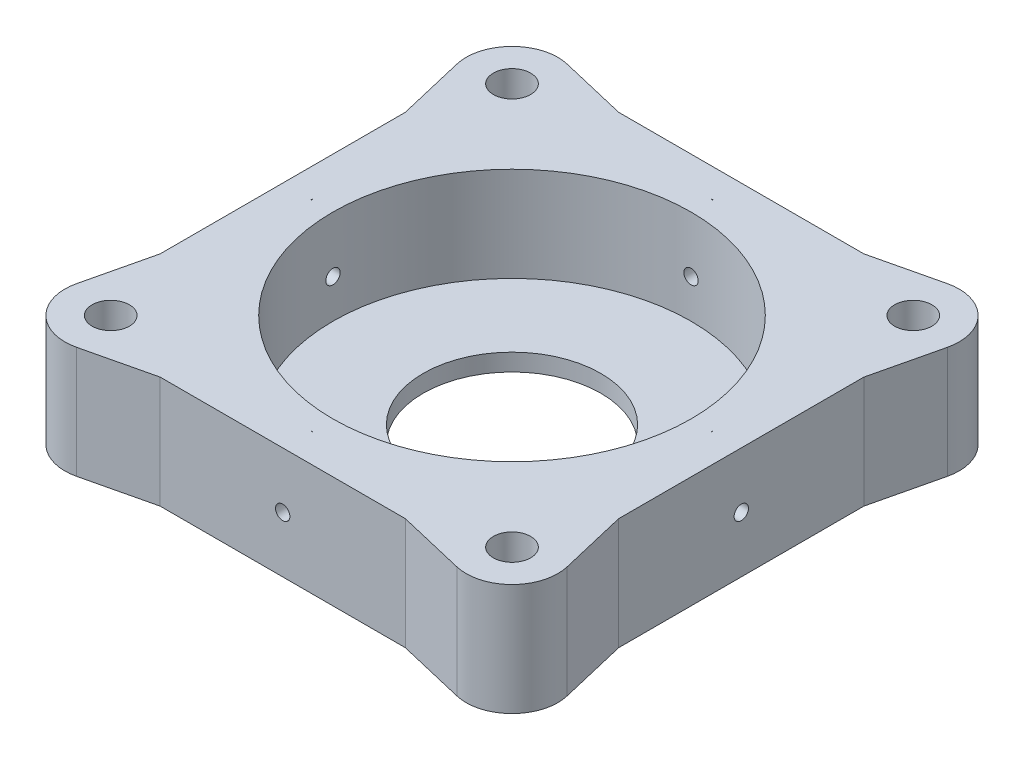
from build123d import *

# Parameters (mm, degrees)
SKETCH1_R           = 34
SKETCH1_R_2         = 15.5
BOSS_EXTRUDE1_DEPTH = 19.5
SKETCH2_R           = 31.25
CUT_EXTRUDE1_DEPTH  = 16.5
SKETCH3_R           = 5
CUT_EXTRUDE2_DEPTH  = 6
CUT_EXTRUDE3_REACH  = 97.49
SKETCH4_R           = 1.25
CUT_EXTRUDE4_REACH  = 97.49
SKETCH5_R           = 1.25


with BuildPart() as part:
    # Sketch1 → Boss-Extrude1 (new body)
    # profile 1 of 61: a face of its own
    with BuildSketch(Plane(origin=(0, 0, 0), x_dir=(1, 0, 0), z_dir=(0, 1, 0))):
        with BuildLine():
            ThreePointArc((-33.157842357, 42.785014786), (-40.656854249, 40.656854249), (-42.785014786, 33.157842357))
            ThreePointArc((-42.785014786, 33.157842357), (-41.760946795, 30.723365993), (-40, 28.755002002))
            Line((-40, 28.755002002), (-40, 40))
            Line((-40, 40), (-28.755002002, 40))
            ThreePointArc((-28.755002002, 40), (-30.723365993, 41.760946795), (-33.157842357, 42.785014786))
        make_face()
    # profile 2 of 61: a face of its own
    with BuildSketch(Plane(origin=(0, 0, 0), x_dir=(1, 0, 0), z_dir=(0, 1, 0))):
        with BuildLine():
            ThreePointArc((-40, 28.755002002), (-37.649529771, 27.451490744), (-35, 27))
            Line((-35, 27), (-35, 31.75))
            ThreePointArc((-35, 31.75), (-37.298097039, 37.298097039), (-31.75, 35))
            Line((-31.75, 35), (-27, 35))
            ThreePointArc((-27, 35), (-27.451490744, 37.649529771), (-28.755002002, 40))
            Line((-28.755002002, 40), (-40, 40))
            Line((-40, 40), (-40, 28.755002002))
        make_face()
    # profile 3 of 61: a face of its own
    with BuildSketch(Plane(origin=(0, 0, 0), x_dir=(1, 0, 0), z_dir=(0, 1, 0))):
        with BuildLine():
            Line((-35, 31.75), (-35, 27))
            ThreePointArc((-35, 27), (-29.343145751, 29.343145751), (-27, 35))
            Line((-27, 35), (-31.75, 35))
            ThreePointArc((-31.75, 35), (-32.701902961, 32.701902961), (-35, 31.75))
        make_face()
    # profile 4 of 61: a face of its own
    with BuildSketch(Plane(origin=(0, 0, 0), x_dir=(1, 0, 0), z_dir=(0, 1, 0))):
        with BuildLine():
            Line((-42.785014786, 33.157842357), (-40, 21.388284323))
            Line((-40, 21.388284323), (-40, 28.755002002))
            ThreePointArc((-40, 28.755002002), (-41.760946795, 30.723365993), (-42.785014786, 33.157842357))
        make_face()
    # profile 5 of 61: a face of its own
    with BuildSketch(Plane(origin=(0, 0, 0), x_dir=(1, 0, 0), z_dir=(0, 1, 0))):
        with BuildLine():
            ThreePointArc((-37.938396612, 12.675885078), (-36.622236567, 16.087628439), (-35, 19.364916731))
            Line((-35, 19.364916731), (-35, 27))
            ThreePointArc((-35, 27), (-37.649529771, 27.451490744), (-40, 28.755002002))
            Line((-40, 28.755002002), (-40, 21.388284323))
            Line((-40, 21.388284323), (-37.938396612, 12.675885078))
        make_face()
    # profile 6 of 61: a face of its own
    with BuildSketch(Plane(origin=(0, 0, 0), x_dir=(1, 0, 0), z_dir=(0, 1, 0))):
        with BuildLine():
            Line((-40, 21.388284323), (-40, 0))
            ThreePointArc((-40, 0), (-39.481235191, 6.421220115), (-37.938396612, 12.675885078))
            Line((-37.938396612, 12.675885078), (-40, 21.388284323))
        make_face()
    # profile 7 of 61: a face of its own
    with BuildSketch(Plane(origin=(0, 0, 0), x_dir=(1, 0, 0), z_dir=(0, 1, 0))):
        with BuildLine():
            Line((-37.938396612, 12.675885078), (-35, 0.258130737))
            Line((-35, 0.258130737), (-35, 19.364916731))
            ThreePointArc((-35, 19.364916731), (-36.622236567, 16.087628439), (-37.938396612, 12.675885078))
        make_face()
    # profile 8 of 61: a face of its own
    with BuildSketch(Plane(origin=(0, 0, 0), x_dir=(1, 0, 0), z_dir=(0, 1, 0))):
        with BuildLine():
            Line((-37.938396612, -12.675885078), (-35, -0.258130737))
            Line((-35, -0.258130737), (-35, 0.258130737))
            Line((-35, 0.258130737), (-37.938396612, 12.675885078))
            ThreePointArc((-37.938396612, 12.675885078), (-39.481235191, 6.421220115), (-40, 0))
            ThreePointArc((-40, 0), (-39.481235191, -6.421220115), (-37.938396612, -12.675885078))
        make_face()
    # profile 9 of 61: a face of its own
    with BuildSketch(Plane(origin=(0, 0, 0), x_dir=(1, 0, 0), z_dir=(0, 1, 0))):
        with BuildLine():
            Line((-40, -21.388284323), (-37.938396612, -12.675885078))
            ThreePointArc((-37.938396612, -12.675885078), (-39.481235191, -6.421220115), (-40, 0))
            Line((-40, 0), (-40, -21.388284323))
        make_face()
    # profile 10 of 61: a face of its own
    with BuildSketch(Plane(origin=(0, 0, 0), x_dir=(1, 0, 0), z_dir=(0, 1, 0))):
        with BuildLine():
            ThreePointArc((-37.938396612, -12.675885078), (-36.622236567, -16.087628439), (-35, -19.364916731))
            Line((-35, -19.364916731), (-35, -0.258130737))
            Line((-35, -0.258130737), (-37.938396612, -12.675885078))
        make_face()
    # profile 11 of 61: a face of its own
    with BuildSketch(Plane(origin=(0, 0, 0), x_dir=(1, 0, 0), z_dir=(0, 1, 0))):
        with BuildLine():
            ThreePointArc((-40, -28.755002002), (-37.649529771, -27.451490744), (-35, -27))
            Line((-35, -27), (-35, -19.364916731))
            ThreePointArc((-35, -19.364916731), (-36.622236567, -16.087628439), (-37.938396612, -12.675885078))
            Line((-37.938396612, -12.675885078), (-40, -21.388284323))
            Line((-40, -21.388284323), (-40, -28.755002002))
        make_face()
    # profile 12 of 61: a face of its own
    with BuildSketch(Plane(origin=(0, 0, 0), x_dir=(1, 0, 0), z_dir=(0, 1, 0))):
        with BuildLine():
            ThreePointArc((-42.785014786, -33.157842357), (-41.760946795, -30.723365993), (-40, -28.755002002))
            Line((-40, -28.755002002), (-40, -21.388284323))
            Line((-40, -21.388284323), (-42.785014786, -33.157842357))
        make_face()
    # profile 13 of 61: a face of its own
    with BuildSketch(Plane(origin=(0, 0, 0), x_dir=(1, 0, 0), z_dir=(0, 1, 0))):
        with BuildLine():
            ThreePointArc((-33.157842357, -42.785014786), (-30.723365993, -41.760946795), (-28.755002002, -40))
            Line((-28.755002002, -40), (-40, -40))
            Line((-40, -40), (-40, -28.755002002))
            ThreePointArc((-40, -28.755002002), (-41.760946795, -30.723365993), (-42.785014786, -33.157842357))
            ThreePointArc((-42.785014786, -33.157842357), (-40.656854249, -40.656854249), (-33.157842357, -42.785014786))
        make_face()
    # profile 14 of 61: a face of its own
    with BuildSketch(Plane(origin=(0, 0, 0), x_dir=(1, 0, 0), z_dir=(0, 1, 0))):
        with BuildLine():
            ThreePointArc((-28.755002002, -40), (-27.451490744, -37.649529771), (-27, -35))
            Line((-27, -35), (-31.75, -35))
            ThreePointArc((-31.75, -35), (-37.298097039, -37.298097039), (-35, -31.75))
            Line((-35, -31.75), (-35, -27))
            ThreePointArc((-35, -27), (-37.649529771, -27.451490744), (-40, -28.755002002))
            Line((-40, -28.755002002), (-40, -40))
            Line((-40, -40), (-28.755002002, -40))
        make_face()
    # profile 15 of 61: a face of its own
    with BuildSketch(Plane(origin=(0, 0, 0), x_dir=(1, 0, 0), z_dir=(0, 1, 0))):
        with BuildLine():
            Line((-31.75, -35), (-27, -35))
            ThreePointArc((-27, -35), (-29.343145751, -29.343145751), (-35, -27))
            Line((-35, -27), (-35, -31.75))
            ThreePointArc((-35, -31.75), (-32.701902961, -32.701902961), (-31.75, -35))
        make_face()
    # profile 16 of 61: a face of its own
    with BuildSketch(Plane(origin=(0, 0, 0), x_dir=(1, 0, 0), z_dir=(0, 1, 0))):
        with BuildLine():
            ThreePointArc((-35, -27), (-29.343145751, -29.343145751), (-27, -35))
            Line((-27, -35), (-19.364916731, -35))
            ThreePointArc((-19.364916731, -35), (-28.284271247, -28.284271247), (-35, -19.364916731))
            Line((-35, -19.364916731), (-35, -27))
        make_face()
    # profile 17 of 61: a face of its own
    with BuildSketch(Plane(origin=(0, 0, 0), x_dir=(1, 0, 0), z_dir=(0, 1, 0))):
        with BuildLine():
            ThreePointArc((-35, -19.364916731), (-28.284271247, -28.284271247), (-19.364916731, -35))
            Line((-19.364916731, -35), (-0.258130737, -35))
            Line((-0.258130737, -35), (0, -34.938918869))
            Line((0, -34.938918869), (-7.829169983, -33.08631284))
            ThreePointArc((-7.829169983, -33.08631284), (-24.04163056, -24.04163056), (-33.08631284, -7.829169983))
            Line((-33.08631284, -7.829169983), (-34.938918869, 0))
            Line((-34.938918869, 0), (-35, -0.258130737))
            Line((-35, -0.258130737), (-35, -19.364916731))
        make_face()
    # profile 18 of 61: a face of its own
    with BuildSketch(Plane(origin=(0, 0, 0), x_dir=(1, 0, 0), z_dir=(0, 1, 0))):
        with BuildLine():
            Line((-35, 19.364916731), (-35, 0.258130737))
            Line((-35, 0.258130737), (-34.938918869, 0))
            Line((-34.938918869, 0), (-33.08631284, 7.829169983))
            ThreePointArc((-33.08631284, 7.829169983), (-24.04163056, 24.04163056), (-7.829169983, 33.08631284))
            Line((-7.829169983, 33.08631284), (0, 34.938918869))
            Line((0, 34.938918869), (-0.258130737, 35))
            Line((-0.258130737, 35), (-19.364916731, 35))
            ThreePointArc((-19.364916731, 35), (-28.284271247, 28.284271247), (-35, 19.364916731))
        make_face()
    # profile 19 of 61: a face of its own
    with BuildSketch(Plane(origin=(0, 0, 0), x_dir=(1, 0, 0), z_dir=(0, 1, 0))):
        with BuildLine():
            Line((-33.08631284, 7.829169983), (-34.938918869, 0))
            Line((-34.938918869, 0), (-33.08631284, -7.829169983))
            ThreePointArc((-33.08631284, -7.829169983), (-34, 0), (-33.08631284, 7.829169983))
        make_face()
    # profile 20 of 61: a face of its own
    with BuildSketch(Plane(origin=(0, 0, 0), x_dir=(1, 0, 0), z_dir=(0, 1, 0))):
        with BuildLine():
            Line((-35, 27), (-35, 19.364916731))
            ThreePointArc((-35, 19.364916731), (-28.284271247, 28.284271247), (-19.364916731, 35))
            Line((-19.364916731, 35), (-27, 35))
            ThreePointArc((-27, 35), (-29.343145751, 29.343145751), (-35, 27))
        make_face()
    # profile 21 of 61: a face of its own
    with BuildSketch(Plane(origin=(0, 0, 0), x_dir=(1, 0, 0), z_dir=(0, 1, 0))):
        with BuildLine():
            Line((-27, 35), (-19.364916731, 35))
            ThreePointArc((-19.364916731, 35), (-16.087628439, 36.622236567), (-12.675885078, 37.938396612))
            Line((-12.675885078, 37.938396612), (-21.388284323, 40))
            Line((-21.388284323, 40), (-28.755002002, 40))
            ThreePointArc((-28.755002002, 40), (-27.451490744, 37.649529771), (-27, 35))
        make_face()
    # profile 22 of 61: a face of its own
    with BuildSketch(Plane(origin=(0, 0, 0), x_dir=(1, 0, 0), z_dir=(0, 1, 0))):
        with BuildLine():
            Line((-21.388284323, 40), (-33.157842357, 42.785014786))
            ThreePointArc((-33.157842357, 42.785014786), (-30.723365993, 41.760946795), (-28.755002002, 40))
            Line((-28.755002002, 40), (-21.388284323, 40))
        make_face()
    # profile 23 of 61: a face of its own
    with BuildSketch(Plane(origin=(0, 0, 0), x_dir=(1, 0, 0), z_dir=(0, 1, 0))):
        with BuildLine():
            Line((-21.388284323, 40), (-12.675885078, 37.938396612))
            ThreePointArc((-12.675885078, 37.938396612), (-6.421220184, 39.48123518), (-1.4e-07, 40))
            Line((-1.4e-07, 40), (-21.388284323, 40))
        make_face()
    # profile 24 of 61: a face of its own
    with BuildSketch(Plane(origin=(0, 0, 0), x_dir=(1, 0, 0), z_dir=(0, 1, 0))):
        with BuildLine():
            ThreePointArc((-12.675885078, 37.938396612), (-16.087628439, 36.622236567), (-19.364916731, 35))
            Line((-19.364916731, 35), (-0.258130737, 35))
            Line((-0.258130737, 35), (-12.675885078, 37.938396612))
        make_face()
    # profile 25 of 61: a face of its own
    with BuildSketch(Plane(origin=(0, 0, 0), x_dir=(1, 0, 0), z_dir=(0, 1, 0))):
        with BuildLine():
            Line((-12.675885078, 37.938396612), (-0.258130737, 35))
            Line((-0.258130737, 35), (0.258130737, 35))
            Line((0.258130737, 35), (12.675885078, 37.938396612))
            ThreePointArc((12.675885078, 37.938396612), (6.421220046, 39.481235203), (-1.4e-07, 40))
            ThreePointArc((-1.4e-07, 40), (-6.421220184, 39.48123518), (-12.675885078, 37.938396612))
        make_face()
    # profile 26 of 61: a face of its own
    with BuildSketch(Plane(origin=(0, 0, 0), x_dir=(1, 0, 0), z_dir=(0, 1, 0))):
        with BuildLine():
            Line((0, 34.938918869), (-7.829169983, 33.08631284))
            ThreePointArc((-7.829169983, 33.08631284), (0, 34), (7.829169983, 33.08631284))
            Line((7.829169983, 33.08631284), (0, 34.938918869))
        make_face()
    # profile 27 of 61: a face of its own
    with BuildSketch(Plane(origin=(0, 0, 0), x_dir=(1, 0, 0), z_dir=(0, 1, 0))):
        with BuildLine():
            Line((12.675885078, 37.938396612), (0.258130737, 35))
            Line((0.258130737, 35), (19.364916731, 35))
            ThreePointArc((19.364916731, 35), (16.087628439, 36.622236567), (12.675885078, 37.938396612))
        make_face()
    # profile 28 of 61: a face of its own
    with BuildSketch(Plane(origin=(0, 0, 0), x_dir=(1, 0, 0), z_dir=(0, 1, 0))):
        with BuildLine():
            Line((33.08631284, 7.829169983), (34.938918869, 0))
            Line((34.938918869, 0), (35, 0.258130737))
            Line((35, 0.258130737), (35, 19.364916731))
            ThreePointArc((35, 19.364916731), (28.284271247, 28.284271247), (19.364916731, 35))
            Line((19.364916731, 35), (0.258130737, 35))
            Line((0.258130737, 35), (0, 34.938918869))
            Line((0, 34.938918869), (7.829169983, 33.08631284))
            ThreePointArc((7.829169983, 33.08631284), (24.04163056, 24.04163056), (33.08631284, 7.829169983))
        make_face()
    # profile 29 of 61: a face of its own
    with BuildSketch(Plane(origin=(0, 0, 0), x_dir=(1, 0, 0), z_dir=(0, 1, 0))):
        with BuildLine():
            ThreePointArc((12.675885078, 37.938396612), (16.087628439, 36.622236567), (19.364916731, 35))
            Line((19.364916731, 35), (27, 35))
            ThreePointArc((27, 35), (27.451490744, 37.649529771), (28.755002002, 40))
            Line((28.755002002, 40), (21.388284323, 40))
            Line((21.388284323, 40), (12.675885078, 37.938396612))
        make_face()
    # profile 30 of 61: a face of its own
    with BuildSketch(Plane(origin=(0, 0, 0), x_dir=(1, 0, 0), z_dir=(0, 1, 0))):
        with BuildLine():
            Line((21.388284323, 40), (-1.4e-07, 40))
            ThreePointArc((-1.4e-07, 40), (6.421220046, 39.481235203), (12.675885078, 37.938396612))
            Line((12.675885078, 37.938396612), (21.388284323, 40))
        make_face()
    # profile 31 of 61: a face of its own
    with BuildSketch(Plane(origin=(0, 0, 0), x_dir=(1, 0, 0), z_dir=(0, 1, 0))):
        with BuildLine():
            Line((33.157842357, 42.785014786), (21.388284323, 40))
            Line((21.388284323, 40), (28.755002002, 40))
            ThreePointArc((28.755002002, 40), (30.723365993, 41.760946795), (33.157842357, 42.785014786))
        make_face()
    # profile 32 of 61: a face of its own
    with BuildSketch(Plane(origin=(0, 0, 0), x_dir=(1, 0, 0), z_dir=(0, 1, 0))):
        with BuildLine():
            ThreePointArc((19.364916731, 35), (28.284271247, 28.284271247), (35, 19.364916731))
            Line((35, 19.364916731), (35, 27))
            ThreePointArc((35, 27), (29.343145751, 29.343145751), (27, 35))
            Line((27, 35), (19.364916731, 35))
        make_face()
    # profile 33 of 61: a face of its own
    with BuildSketch(Plane(origin=(0, 0, 0), x_dir=(1, 0, 0), z_dir=(0, 1, 0))):
        with BuildLine():
            ThreePointArc((27, 35), (29.343145751, 29.343145751), (35, 27))
            Line((35, 27), (35, 31.75))
            ThreePointArc((35, 31.75), (32.701902961, 32.701902961), (31.75, 35))
            Line((31.75, 35), (27, 35))
        make_face()
    # profile 34 of 61: a face of its own
    with BuildSketch(Plane(origin=(0, 0, 0), x_dir=(1, 0, 0), z_dir=(0, 1, 0))):
        with BuildLine():
            Line((35, 31.75), (35, 27))
            ThreePointArc((35, 27), (37.649529771, 27.451490744), (40, 28.755002002))
            Line((40, 28.755002002), (40, 40))
            Line((40, 40), (28.755002002, 40))
            ThreePointArc((28.755002002, 40), (27.451490744, 37.649529771), (27, 35))
            Line((27, 35), (31.75, 35))
            ThreePointArc((31.75, 35), (35, 38.25), (38.25, 35))
            ThreePointArc((38.25, 35), (37.298097039, 32.701902961), (35, 31.75))
        make_face()
    # profile 35 of 61: a face of its own
    with BuildSketch(Plane(origin=(0, 0, 0), x_dir=(1, 0, 0), z_dir=(0, 1, 0))):
        with BuildLine():
            ThreePointArc((40, 28.755002002), (41.760946795, 30.723365993), (42.785014786, 33.157842357))
            ThreePointArc((42.785014786, 33.157842357), (42.946071932, 34.072670039), (43, 35))
            ThreePointArc((43, 35), (39.963000043, 41.27444265), (33.157842357, 42.785014786))
            ThreePointArc((33.157842357, 42.785014786), (30.723365993, 41.760946795), (28.755002002, 40))
            Line((28.755002002, 40), (40, 40))
            Line((40, 40), (40, 28.755002002))
        make_face()
    # profile 36 of 61: a face of its own
    with BuildSketch(Plane(origin=(0, 0, 0), x_dir=(1, 0, 0), z_dir=(0, 1, 0))):
        with BuildLine():
            Line((40, 28.755002002), (40, 21.388284323))
            Line((40, 21.388284323), (42.785014786, 33.157842357))
            ThreePointArc((42.785014786, 33.157842357), (41.760946795, 30.723365993), (40, 28.755002002))
        make_face()
    # profile 37 of 61: a face of its own
    with BuildSketch(Plane(origin=(0, 0, 0), x_dir=(1, 0, 0), z_dir=(0, 1, 0))):
        with BuildLine():
            Line((35, 27), (35, 19.364916731))
            ThreePointArc((35, 19.364916731), (36.622236567, 16.087628439), (37.938396612, 12.675885078))
            Line((37.938396612, 12.675885078), (40, 21.388284323))
            Line((40, 21.388284323), (40, 28.755002002))
            ThreePointArc((40, 28.755002002), (37.649529771, 27.451490744), (35, 27))
        make_face()
    # profile 38 of 61: a face of its own
    with BuildSketch(Plane(origin=(0, 0, 0), x_dir=(1, 0, 0), z_dir=(0, 1, 0))):
        with BuildLine():
            ThreePointArc((37.938396612, 12.675885078), (39.481235191, 6.421220115), (40, 0))
            Line((40, 0), (40, 21.388284323))
            Line((40, 21.388284323), (37.938396612, 12.675885078))
        make_face()
    # profile 39 of 61: a face of its own
    with BuildSketch(Plane(origin=(0, 0, 0), x_dir=(1, 0, 0), z_dir=(0, 1, 0))):
        with BuildLine():
            Line((35, 19.364916731), (35, 0.258130737))
            Line((35, 0.258130737), (37.938396612, 12.675885078))
            ThreePointArc((37.938396612, 12.675885078), (36.622236567, 16.087628439), (35, 19.364916731))
        make_face()
    # profile 40 of 61: a face of its own
    with BuildSketch(Plane(origin=(0, 0, 0), x_dir=(1, 0, 0), z_dir=(0, 1, 0))):
        with BuildLine():
            Line((35, 0.258130737), (35, -0.258130737))
            Line((35, -0.258130737), (37.938396612, -12.675885078))
            ThreePointArc((37.938396612, -12.675885078), (39.481235191, -6.421220115), (40, 0))
            ThreePointArc((40, 0), (39.481235191, 6.421220115), (37.938396612, 12.675885078))
            Line((37.938396612, 12.675885078), (35, 0.258130737))
        make_face()
    # profile 41 of 61: a face of its own
    with BuildSketch(Plane(origin=(0, 0, 0), x_dir=(1, 0, 0), z_dir=(0, 1, 0))):
        with BuildLine():
            ThreePointArc((40, 0), (39.481235191, -6.421220115), (37.938396612, -12.675885078))
            Line((37.938396612, -12.675885078), (40, -21.388284323))
            Line((40, -21.388284323), (40, 0))
        make_face()
    # profile 42 of 61: a face of its own
    with BuildSketch(Plane(origin=(0, 0, 0), x_dir=(1, 0, 0), z_dir=(0, 1, 0))):
        with BuildLine():
            Line((35, -0.258130737), (35, -19.364916731))
            ThreePointArc((35, -19.364916731), (36.622236567, -16.087628439), (37.938396612, -12.675885078))
            Line((37.938396612, -12.675885078), (35, -0.258130737))
        make_face()
    # profile 43 of 61: a face of its own
    with BuildSketch(Plane(origin=(0, 0, 0), x_dir=(1, 0, 0), z_dir=(0, 1, 0))):
        with BuildLine():
            ThreePointArc((34, 0), (33.77080571, -3.941152333), (33.08631284, -7.829169983))
            Line((33.08631284, -7.829169983), (34.938918869, 0))
            Line((34.938918869, 0), (33.08631284, 7.829169983))
            ThreePointArc((33.08631284, 7.829169983), (33.77080571, 3.941152333), (34, 0))
        make_face()
    # profile 44 of 61: a face of its own
    with BuildSketch(Plane(origin=(0, 0, 0), x_dir=(1, 0, 0), z_dir=(0, 1, 0))):
        with BuildLine():
            Line((0, -34.938918869), (0.258130737, -35))
            Line((0.258130737, -35), (19.364916731, -35))
            ThreePointArc((19.364916731, -35), (28.284271247, -28.284271247), (35, -19.364916731))
            Line((35, -19.364916731), (35, -0.258130737))
            Line((35, -0.258130737), (34.938918869, 0))
            Line((34.938918869, 0), (33.08631284, -7.829169983))
            ThreePointArc((33.08631284, -7.829169983), (24.04163056, -24.04163056), (7.829169983, -33.08631284))
            Line((7.829169983, -33.08631284), (0, -34.938918869))
        make_face()
    # profile 45 of 61: a face of its own
    with BuildSketch(Plane(origin=(0, 0, 0), x_dir=(1, 0, 0), z_dir=(0, 1, 0))):
        with BuildLine():
            ThreePointArc((37.938396612, -12.675885078), (36.622236567, -16.087628439), (35, -19.364916731))
            Line((35, -19.364916731), (35, -27))
            ThreePointArc((35, -27), (37.649529771, -27.451490744), (40, -28.755002002))
            Line((40, -28.755002002), (40, -21.388284323))
            Line((40, -21.388284323), (37.938396612, -12.675885078))
        make_face()
    # profile 46 of 61: a face of its own
    with BuildSketch(Plane(origin=(0, 0, 0), x_dir=(1, 0, 0), z_dir=(0, 1, 0))):
        with BuildLine():
            Line((40, -21.388284323), (40, -28.755002002))
            ThreePointArc((40, -28.755002002), (41.760946795, -30.723365993), (42.785014786, -33.157842357))
            Line((42.785014786, -33.157842357), (40, -21.388284323))
        make_face()
    # profile 47 of 61: a face of its own
    with BuildSketch(Plane(origin=(0, 0, 0), x_dir=(1, 0, 0), z_dir=(0, 1, 0))):
        with BuildLine():
            ThreePointArc((35, -19.364916731), (28.284271247, -28.284271247), (19.364916731, -35))
            Line((19.364916731, -35), (27, -35))
            ThreePointArc((27, -35), (29.343145751, -29.343145751), (35, -27))
            Line((35, -27), (35, -19.364916731))
        make_face()
    # profile 48 of 61: a face of its own
    with BuildSketch(Plane(origin=(0, 0, 0), x_dir=(1, 0, 0), z_dir=(0, 1, 0))):
        with BuildLine():
            Line((31.75, -35), (27, -35))
            ThreePointArc((27, -35), (27.451490744, -37.649529771), (28.755002002, -40))
            Line((28.755002002, -40), (40, -40))
            Line((40, -40), (40, -28.755002002))
            ThreePointArc((40, -28.755002002), (37.649529771, -27.451490744), (35, -27))
            Line((35, -27), (35, -31.75))
            ThreePointArc((35, -31.75), (37.298097039, -32.701902961), (38.25, -35))
            ThreePointArc((38.25, -35), (35, -38.25), (31.75, -35))
        make_face()
    # profile 49 of 61: a face of its own
    with BuildSketch(Plane(origin=(0, 0, 0), x_dir=(1, 0, 0), z_dir=(0, 1, 0))):
        with BuildLine():
            ThreePointArc((35, -27), (29.343145751, -29.343145751), (27, -35))
            Line((27, -35), (31.75, -35))
            ThreePointArc((31.75, -35), (32.701902961, -32.701902961), (35, -31.75))
            Line((35, -31.75), (35, -27))
        make_face()
    # profile 50 of 61: a face of its own
    with BuildSketch(Plane(origin=(0, 0, 0), x_dir=(1, 0, 0), z_dir=(0, 1, 0))):
        with BuildLine():
            ThreePointArc((28.755002002, -40), (30.723365993, -41.760946795), (33.157842357, -42.785014786))
            ThreePointArc((33.157842357, -42.785014786), (39.963000043, -41.27444265), (43, -35))
            ThreePointArc((43, -35), (42.946071932, -34.072670039), (42.785014786, -33.157842357))
            ThreePointArc((42.785014786, -33.157842357), (41.760946795, -30.723365993), (40, -28.755002002))
            Line((40, -28.755002002), (40, -40))
            Line((40, -40), (28.755002002, -40))
        make_face()
    # profile 51 of 61: a face of its own
    with BuildSketch(Plane(origin=(0, 0, 0), x_dir=(1, 0, 0), z_dir=(0, 1, 0))):
        with BuildLine():
            Line((28.755002002, -40), (21.388284323, -40))
            Line((21.388284323, -40), (33.157842357, -42.785014786))
            ThreePointArc((33.157842357, -42.785014786), (30.723365993, -41.760946795), (28.755002002, -40))
        make_face()
    # profile 52 of 61: a face of its own
    with BuildSketch(Plane(origin=(0, 0, 0), x_dir=(1, 0, 0), z_dir=(0, 1, 0))):
        with BuildLine():
            Line((27, -35), (19.364916731, -35))
            ThreePointArc((19.364916731, -35), (16.087628439, -36.622236567), (12.675885078, -37.938396612))
            Line((12.675885078, -37.938396612), (21.388284323, -40))
            Line((21.388284323, -40), (28.755002002, -40))
            ThreePointArc((28.755002002, -40), (27.451490744, -37.649529771), (27, -35))
        make_face()
    # profile 53 of 61: a face of its own
    with BuildSketch(Plane(origin=(0, 0, 0), x_dir=(1, 0, 0), z_dir=(0, 1, 0))):
        with BuildLine():
            Line((19.364916731, -35), (0.258130737, -35))
            Line((0.258130737, -35), (12.675885078, -37.938396612))
            ThreePointArc((12.675885078, -37.938396612), (16.087628439, -36.622236567), (19.364916731, -35))
        make_face()
    # profile 54 of 61: a face of its own
    with BuildSketch(Plane(origin=(0, 0, 0), x_dir=(1, 0, 0), z_dir=(0, 1, 0))):
        with BuildLine():
            ThreePointArc((12.675885078, -37.938396612), (6.421220115, -39.481235191), (0, -40))
            Line((0, -40), (21.388284323, -40))
            Line((21.388284323, -40), (12.675885078, -37.938396612))
        make_face()
    # profile 55 of 61: a face of its own
    with BuildSketch(Plane(origin=(0, 0, 0), x_dir=(1, 0, 0), z_dir=(0, 1, 0))):
        with BuildLine():
            Line((0.258130737, -35), (-0.258130737, -35))
            Line((-0.258130737, -35), (-12.675885078, -37.938396612))
            ThreePointArc((-12.675885078, -37.938396612), (-6.421220115, -39.481235191), (0, -40))
            ThreePointArc((0, -40), (6.421220115, -39.481235191), (12.675885078, -37.938396612))
            Line((12.675885078, -37.938396612), (0.258130737, -35))
        make_face()
    # profile 56 of 61: a face of its own
    with BuildSketch(Plane(origin=(0, 0, 0), x_dir=(1, 0, 0), z_dir=(0, 1, 0))):
        with BuildLine():
            Line((-7.829169983, -33.08631284), (0, -34.938918869))
            Line((0, -34.938918869), (7.829169983, -33.08631284))
            ThreePointArc((7.829169983, -33.08631284), (0, -34), (-7.829169983, -33.08631284))
        make_face()
    # profile 57 of 61: a face of its own
    with BuildSketch(Plane(origin=(0, 0, 0), x_dir=(1, 0, 0), z_dir=(0, 1, 0))):
        with BuildLine():
            Line((-0.258130737, -35), (-19.364916731, -35))
            ThreePointArc((-19.364916731, -35), (-16.087628439, -36.622236567), (-12.675885078, -37.938396612))
            Line((-12.675885078, -37.938396612), (-0.258130737, -35))
        make_face()
    # profile 58 of 61: a face of its own
    with BuildSketch(Plane(origin=(0, 0, 0), x_dir=(1, 0, 0), z_dir=(0, 1, 0))):
        with BuildLine():
            ThreePointArc((0, -40), (-6.421220115, -39.481235191), (-12.675885078, -37.938396612))
            Line((-12.675885078, -37.938396612), (-21.388284323, -40))
            Line((-21.388284323, -40), (0, -40))
        make_face()
    # profile 59 of 61: a face of its own
    with BuildSketch(Plane(origin=(0, 0, 0), x_dir=(1, 0, 0), z_dir=(0, 1, 0))):
        with BuildLine():
            Line((-19.364916731, -35), (-27, -35))
            ThreePointArc((-27, -35), (-27.451490744, -37.649529771), (-28.755002002, -40))
            Line((-28.755002002, -40), (-21.388284323, -40))
            Line((-21.388284323, -40), (-12.675885078, -37.938396612))
            ThreePointArc((-12.675885078, -37.938396612), (-16.087628439, -36.622236567), (-19.364916731, -35))
        make_face()
    # profile 60 of 61: a face of its own
    with BuildSketch(Plane(origin=(0, 0, 0), x_dir=(1, 0, 0), z_dir=(0, 1, 0))):
        with BuildLine():
            Line((-21.388284323, -40), (-28.755002002, -40))
            ThreePointArc((-28.755002002, -40), (-30.723365993, -41.760946795), (-33.157842357, -42.785014786))
            Line((-33.157842357, -42.785014786), (-21.388284323, -40))
        make_face()
    # profile 61 of 61: a face of its own
    with BuildSketch(Plane(origin=(0, 0, 0), x_dir=(1, 0, 0), z_dir=(0, 1, 0))):
        Circle(SKETCH1_R)
        with Locations(Location((0, 0, 0), (0, 0, 270))):
            Circle(SKETCH1_R_2, mode=Mode.SUBTRACT)
    extrude(amount=BOSS_EXTRUDE1_DEPTH)

    # Sketch2 → Cut-Extrude1 (cut)
    with BuildSketch(Plane(origin=(0, 19.5, 0), x_dir=(1, 0, 0), z_dir=(0, 1, 0))):
        with Locations(Location((0, 0, 0), (0, 0, 270))):
            Circle(SKETCH2_R)
    extrude(amount=-CUT_EXTRUDE1_DEPTH, mode=Mode.SUBTRACT)

    # Sketch3 → Cut-Extrude2 (cut)
    with BuildSketch(Plane.XZ):
        with Locations(Location((-35, 35, 0), (0, 0, 270))):
            Circle(SKETCH3_R)
        with Locations(Location((35, 35, 0), (0, 0, 270))):
            Circle(SKETCH3_R)
        with Locations(Location((35, -35, 0), (0, 0, 270))):
            Circle(SKETCH3_R)
        with Locations(Location((-35, -35, 0), (0, 0, 270))):
            Circle(SKETCH3_R)
    extrude(amount=-CUT_EXTRUDE2_DEPTH, mode=Mode.SUBTRACT)

    # Cut-Extrude3: up to this face of the body (flat: up to its plane)
    cut_extrude3_end = Plane(part.part.faces().sort_by_distance((0, 9.75, -40))[0])
    # Sketch4 → Cut-Extrude3 (cut, up to the picked face)
    with BuildSketch(Plane.XY.offset(40), mode=Mode.PRIVATE) as cut_extrude3_sk1:
        with Locations((0, 9.75)):
            Circle(SKETCH4_R)
    cut_extrude3_tool1 = split(extrude(cut_extrude3_sk1.sketch, amount=-CUT_EXTRUDE3_REACH, mode=Mode.PRIVATE), bisect_by=cut_extrude3_end, keep=Keep.BOTH, mode=Mode.PRIVATE)
    add(cut_extrude3_tool1.solids().sort_by(Axis((0, 9.75, 40), (0, 0, -1)))[0], mode=Mode.SUBTRACT)

    # Cut-Extrude4: up to this face of the body (flat: up to its plane)
    cut_extrude4_end = Plane(part.part.faces().sort_by_distance((-40, 9.75, 0))[0])
    # Sketch5 → Cut-Extrude4 (cut, up to the picked face)
    with BuildSketch(Plane(origin=(40, 0, 0), x_dir=(0, 0, -1), z_dir=(1, 0, 0)), mode=Mode.PRIVATE) as cut_extrude4_sk1:
        with Locations((0, 9.75)):
            Circle(SKETCH5_R)
    cut_extrude4_tool1 = split(extrude(cut_extrude4_sk1.sketch, amount=-CUT_EXTRUDE4_REACH, mode=Mode.PRIVATE), bisect_by=cut_extrude4_end, keep=Keep.BOTH, mode=Mode.PRIVATE)
    add(cut_extrude4_tool1.solids().sort_by(Axis((40, 9.75, 0), (-1, 0, 0)))[0], mode=Mode.SUBTRACT)


solid = part.part
